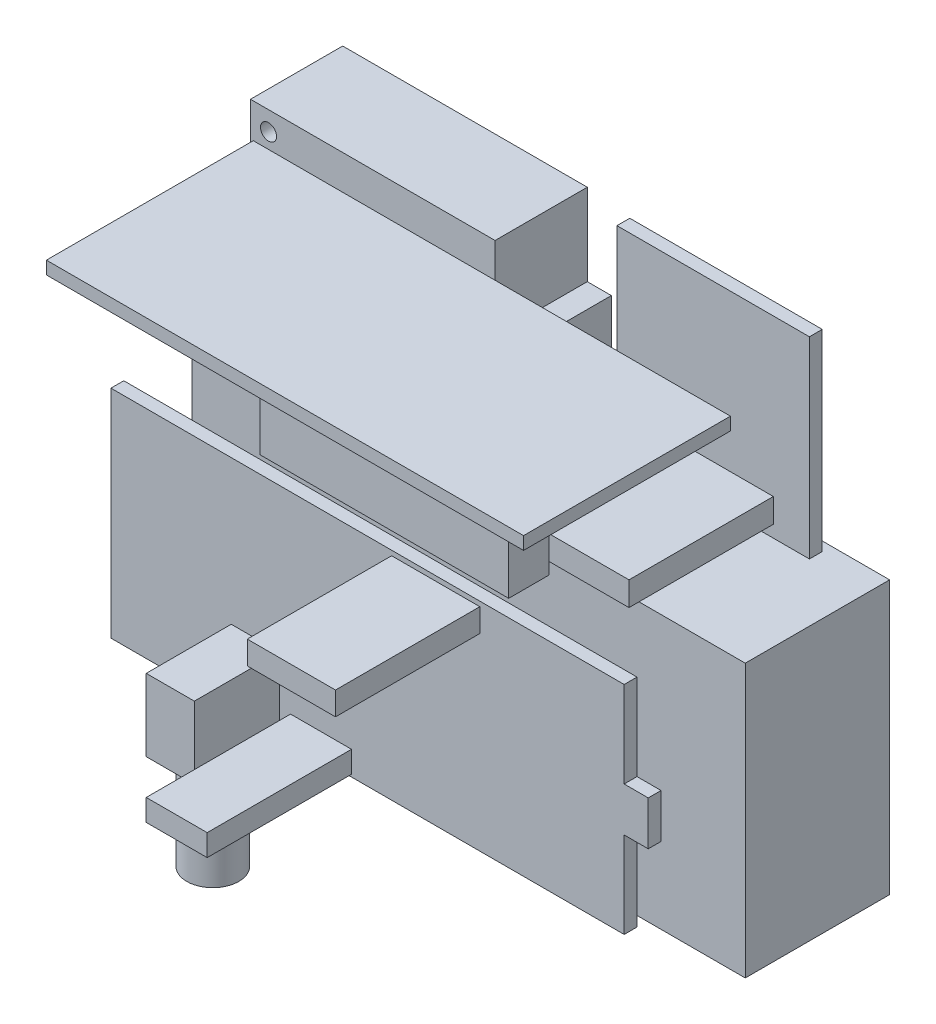
from build123d import *

# Parameters (mm, degrees)
BATTERY_START                               = 4
BATTERY_HOLDER_69_X_34_X_18_PROFILE_W       = 69
BATTERY_HOLDER_69_X_34_X_18_PROFILE_H       = 34
BATTERY_HOLDER_69_X_34_X_18_DEPTH           = 18
YBX_START                                   = 6.4
YBX_BOARD_24_X_24_PROFILE_W                 = 24
YBX_BOARD_24_X_24_PROFILE_H                 = 24
YBX_BOARD_24_X_24_DEPTH                     = 1.6
YBX_START_2                                 = 8
YBX_JUMPER_ALLOWANCE_PROFILE_W              = 15
YBX_JUMPER_ALLOWANCE_PROFILE_H              = 3
YBX_JUMPER_ALLOWANCE_DEPTH                  = 18
GNSS_START                                  = 6.4
GNSS_11_5_MM_HIGH_3_MM_PROJECTION_2_R       = 1
GNSS_11_5_MM_HIGH_3_MM_PROJECTION_D2_DEPTH  = 11.5
POWER_START                                 = 19.1
POWER_BOARD_59_5_X_25_8_PROFILE_W           = 59.5
POWER_BOARD_59_5_X_25_8_PROFILE_H           = 1.6
POWER_BOARD_59_5_X_25_8_DEPTH               = 25.8
POWER_START_2                               = 30
POWER_HORIZONTAL_CONNECTOR_ALLOWANCE_PRO_W  = 31
POWER_HORIZONTAL_CONNECTOR_ALLOWANCE_PRO_H  = 16
POWER_HORIZONTAL_CONNECTOR_ALLOWANCE_DEPTH  = 5
EORA_START                                  = 33
EORA_64_X_27_TOP_PROJECTION_3_X_5_5_DEPTH   = 1.6
EORA_START_2                                = 34.6
EORA_ANTENNA_HOUSING_6_X_9_X_10_6_PROFIL_W  = 6
EORA_ANTENNA_HOUSING_6_X_9_X_10_6_PROFIL_H  = 9
EORA_ANTENNA_HOUSING_6_X_9_X_10_6_DEPTH     = 10.6
D6_5_ANTENNA_PASSAGE_GAUGE_LENGTH_2_R       = 3.25
D6_5_ANTENNA_PASSAGE_GAUGE_LENGTH_NOT_DEPTH = 13
EORA_JUMPER_ALLOWANCE_A_PROFILE_W           = 7.6
EORA_JUMPER_ALLOWANCE_A_PROFILE_H           = 2.7
EORA_JUMPER_ALLOWANCE_A_DEPTH               = 18
EORA_JUMPER_ALLOWANCE_B_PROFILE_W           = 11
EORA_JUMPER_ALLOWANCE_B_PROFILE_H           = 2.9
EORA_JUMPER_ALLOWANCE_B_DEPTH               = 18


with BuildPart() as part:
    # Battery holder 69 x 34 x 18 profile → Battery holder 69 x 34 x 18 (new body)
    with BuildSketch(Plane.XY.offset(BATTERY_START)):
        with Locations((0, -12.75)):
            Rectangle(BATTERY_HOLDER_69_X_34_X_18_PROFILE_W, BATTERY_HOLDER_69_X_34_X_18_PROFILE_H)
    extrude(amount=BATTERY_HOLDER_69_X_34_X_18_DEPTH)


with BuildPart() as body_2:
    # YBX board 24 x 24 profile → YBX board 24 x 24 (new body)
    with BuildSketch(Plane.XY.offset(YBX_START)):
        with Locations((16.5, 17.5)):
            Rectangle(YBX_BOARD_24_X_24_PROFILE_W, YBX_BOARD_24_X_24_PROFILE_H)
    extrude(amount=YBX_BOARD_24_X_24_DEPTH)


with BuildPart() as body_3:
    # YBX jumper allowance profile → YBX jumper allowance (new body)
    with BuildSketch(Plane.XY.offset(YBX_START_2)):
        with Locations((16.5, 8.5)):
            Rectangle(YBX_JUMPER_ALLOWANCE_PROFILE_W, YBX_JUMPER_ALLOWANCE_PROFILE_H)
    extrude(amount=YBX_JUMPER_ALLOWANCE_DEPTH)


with BuildPart() as body_4:
    # GNSS 11.5 mm high - 3 mm projection  2 → GNSS 11.5 mm high - 3 mm projection - D2 (new body)
    with BuildSketch(Plane.XY.offset(GNSS_START)):
        Polygon((-31.3, 4.7), (-0.8, 4.7), (-0.8, 13), (2.2, 13), (2.2, 20), (-0.8, 20), (-0.8, 30.2), (-31.3, 30.2), align=None)
        with Locations((-29.05, 7)):
            Circle(GNSS_11_5_MM_HIGH_3_MM_PROJECTION_2_R, mode=Mode.SUBTRACT)
        with Locations((-29.05, 27.8)):
            Circle(GNSS_11_5_MM_HIGH_3_MM_PROJECTION_2_R, mode=Mode.SUBTRACT)
    extrude(amount=GNSS_11_5_MM_HIGH_3_MM_PROJECTION_D2_DEPTH)


with BuildPart() as body_5:
    # Power board 59.5 x 25.8 profile → Power board 59.5 x 25.8 (new body)
    with BuildSketch(Plane.XY.offset(POWER_START)):
        with Locations((0, 26.3)):
            Rectangle(POWER_BOARD_59_5_X_25_8_PROFILE_W, POWER_BOARD_59_5_X_25_8_PROFILE_H)
    extrude(amount=POWER_BOARD_59_5_X_25_8_DEPTH)


with BuildPart() as body_6:
    # Power horizontal connector allowance profile → Power horizontal connector allowance (new body)
    with BuildSketch(Plane.XY.offset(POWER_START_2)):
        with Locations((2.5, 17.5)):
            Rectangle(POWER_HORIZONTAL_CONNECTOR_ALLOWANCE_PRO_W, POWER_HORIZONTAL_CONNECTOR_ALLOWANCE_PRO_H)
    extrude(amount=POWER_HORIZONTAL_CONNECTOR_ALLOWANCE_DEPTH)


with BuildPart() as body_7:
    # EoRa 64 x 27 - top projection 3 x 5.5 profile → EoRa 64 x 27 - top projection 3 x 5.5 (new body)
    with BuildSketch(Plane.XY.offset(EORA_START)):
        Polygon((-32, -20), (32, -20), (32, -9.25), (35, -9.25), (35, -3.75), (32, -3.75), (32, 7), (-32, 7), align=None)
    extrude(amount=EORA_64_X_27_TOP_PROJECTION_3_X_5_5_DEPTH)


with BuildPart() as body_8:
    # EoRa antenna housing 6 x 9 x 10.6 profile → EoRa antenna housing 6 x 9 x 10.6 (new body)
    with BuildSketch(Plane.XY.offset(EORA_START_2)):
        with Locations((-14, -15.5)):
            Rectangle(EORA_ANTENNA_HOUSING_6_X_9_X_10_6_PROFIL_W, EORA_ANTENNA_HOUSING_6_X_9_X_10_6_PROFIL_H)
    extrude(amount=EORA_ANTENNA_HOUSING_6_X_9_X_10_6_DEPTH)


with BuildPart() as body_9:
    # D6.5 antenna passage gauge - length  2 → D6.5 antenna passage gauge - length not (new body)
    with BuildSketch(Plane.XZ.offset(20)):
        with Locations(Location((-14, 39.9, 0), (0, 0, 90))):
            Circle(D6_5_ANTENNA_PASSAGE_GAUGE_LENGTH_2_R)
    extrude(amount=D6_5_ANTENNA_PASSAGE_GAUGE_LENGTH_NOT_DEPTH)


with BuildPart() as body_10:
    # EoRa jumper allowance A profile → EoRa jumper allowance A (new body)
    with BuildSketch(Plane.XY.offset(EORA_START_2)):
        with Locations((-5.8, -18.35)):
            Rectangle(EORA_JUMPER_ALLOWANCE_A_PROFILE_W, EORA_JUMPER_ALLOWANCE_A_PROFILE_H)
    extrude(amount=EORA_JUMPER_ALLOWANCE_A_DEPTH)


with BuildPart() as body_11:
    # EoRa jumper allowance B profile → EoRa jumper allowance B (new body)
    with BuildSketch(Plane.XY.offset(EORA_START_2)):
        with Locations((8.5, 4.95)):
            Rectangle(EORA_JUMPER_ALLOWANCE_B_PROFILE_W, EORA_JUMPER_ALLOWANCE_B_PROFILE_H)
    extrude(amount=EORA_JUMPER_ALLOWANCE_B_DEPTH)


solid = Compound([part.part, body_2.part, body_3.part, body_4.part, body_5.part, body_6.part, body_7.part, body_8.part, body_9.part, body_10.part, body_11.part])
